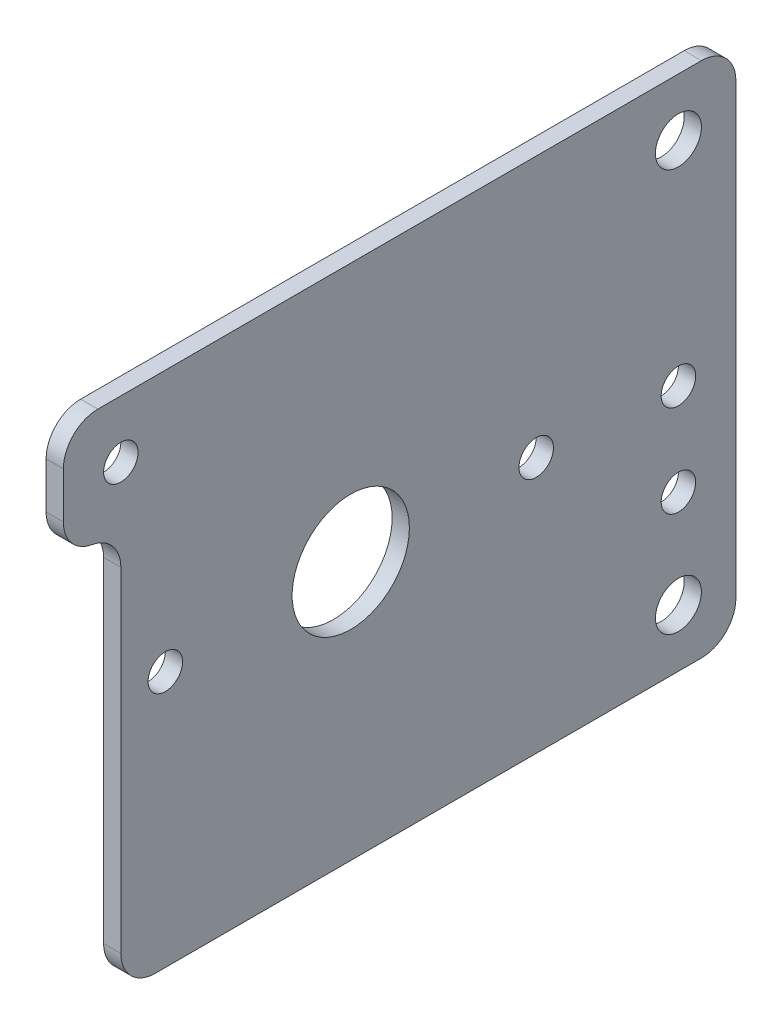
from build123d import *

# Parameters (mm, degrees)
SKETCH_1_W          = 53.5
SKETCH_1_H          = 45
SKETCH_1_R          = 5.1
SKETCH_1_R_2        = 2
SKETCH_1_R_3        = 1.5
EXTRUDE_1_DEPTH     = 1.5
SKETCH_3_W          = 5
SKETCH_3_H          = 10
EXTRUDE_2_DEPTH     = 1.5
SKETCH_4_R          = 1.5
CUT_EXTRUDE_2_DEPTH = 39.943067419
FILLET_1_R          = 3
FILLET_2_R          = 3


with BuildPart() as part:
    # ｽｹｯﾁ1 → ﾎﾞｽ - 押し出し1 (new body)
    with BuildSketch(Plane(origin=(0, 0, 0), x_dir=(0, 0, -1), z_dir=(1, 0, 0))):
        Rectangle(SKETCH_1_W, SKETCH_1_H)
        with Locations((-6.75, 0)):
            Circle(SKETCH_1_R, mode=Mode.SUBTRACT)
        with Locations((21.75, 17.5)):
            Circle(SKETCH_1_R_2, mode=Mode.SUBTRACT)
        with Locations((-22.88, -0.21)):
            Circle(SKETCH_1_R_3, mode=Mode.SUBTRACT)
        with Locations(Location((9.38, -0.21, 0), (0, 0, 180))):
            Circle(SKETCH_1_R_3, mode=Mode.SUBTRACT)
        with Locations((21.75, -1)):
            Circle(SKETCH_1_R_3, mode=Mode.SUBTRACT)
        with Locations(Location((21.75, -17.5, 0), (0, 0, 180))):
            Circle(SKETCH_1_R_2, mode=Mode.SUBTRACT)
        with Locations((21.75, -9)):
            Circle(SKETCH_1_R_3, mode=Mode.SUBTRACT)
    extrude(amount=EXTRUDE_1_DEPTH)

    # ｽｹｯﾁ3 → ﾎﾞｽ - 押し出し2 (add)
    with BuildSketch(Plane(origin=(1.5, 0, 0), x_dir=(0, 0, -1), z_dir=(1, 0, 0))):
        with Locations((-29.25, 17.5)):
            Rectangle(SKETCH_3_W, SKETCH_3_H)
    extrude(amount=-EXTRUDE_2_DEPTH)

    # ｽｹｯﾁ4 → ｶｯﾄ - 押し出し2 (cut, through all)
    with BuildSketch(Plane(origin=(1.5, 0, 0), x_dir=(0, 0, -1), z_dir=(1, 0, 0))):
        with Locations((-26.75, 17.5)):
            Circle(SKETCH_4_R)
    extrude(amount=-CUT_EXTRUDE_2_DEPTH, mode=Mode.SUBTRACT)

    # ﾌｨﾚｯﾄ1
    fillet_1_edges = [part.edges().sort_by_distance(p)[0] for p in [
        (0.75, 22.5, 31.75),
        (0.75, 12.5, 31.75),
        (0.75, -22.5, -26.75),
        (0.75, -22.5, 26.75),
        (0.75, 22.5, -26.75),
    ]]
    fillet(fillet_1_edges, radius=FILLET_1_R)

    # ﾌｨﾚｯﾄ2
    fillet_2_edges = [part.edges().sort_by_distance(p)[0] for p in [
        (0.75, 12.5, 26.75),
    ]]
    fillet(fillet_2_edges, radius=FILLET_2_R)


solid = part.part
